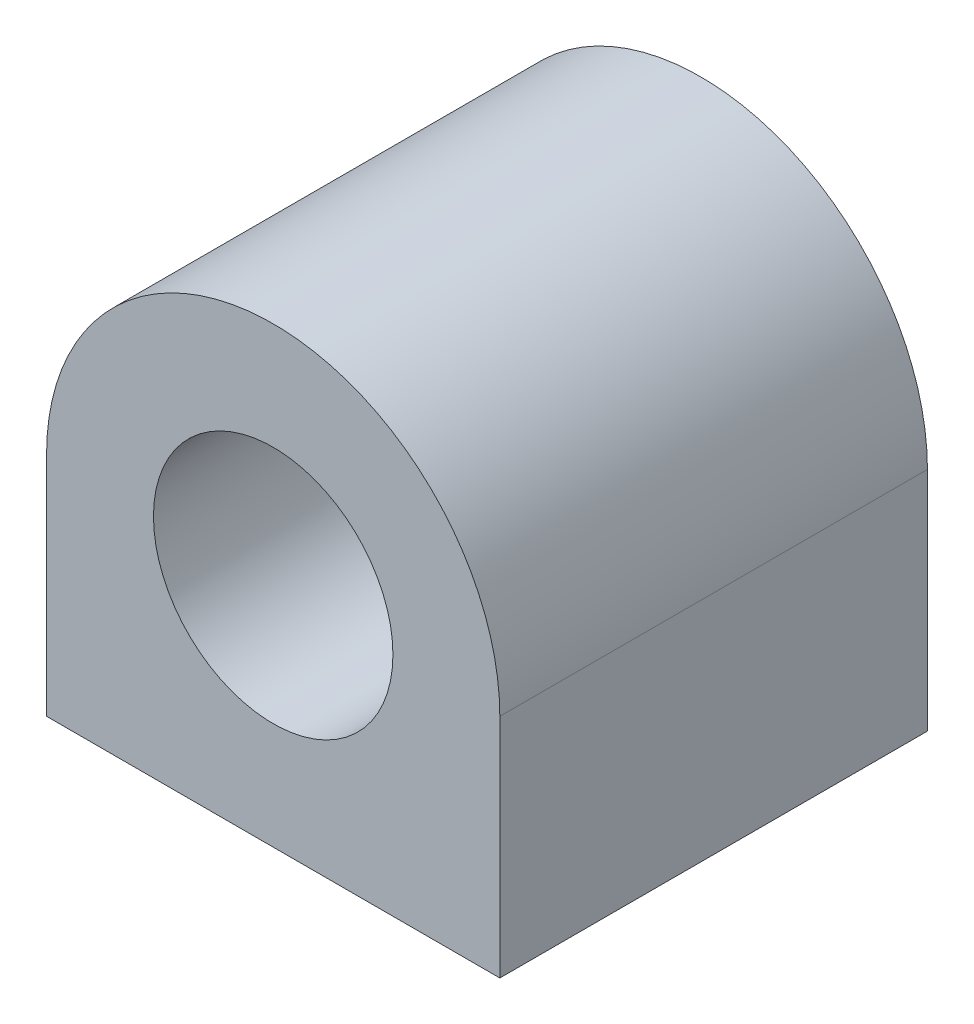
from build123d import *

# Parameters (mm, degrees)
SKETCH_1_R            = 5.6
EXTRUDE_394_DEPTH     = 10
SKETCH_3_R            = 1.2
CUT_EXTRUDE_678_DEPTH = 11


with BuildPart() as part:
    # Эскиз1 → Extrude 394 (new, symmetric)
    with BuildSketch(Plane.XY):
        with BuildLine():
            Line((-10.6, 0), (-10.6, -10.6))
            Line((-10.6, -10.6), (10.6, -10.6))
            Line((10.6, -10.6), (10.6, 0))
            ThreePointArc((10.6, 0), (0, 10.6), (-10.6, 0))
        make_face()
        Circle(SKETCH_1_R, mode=Mode.SUBTRACT)
    extrude(amount=EXTRUDE_394_DEPTH, both=True)

    # Эскиз3 → Cut-Extrude 678 (cut)
    with BuildSketch(Plane.XZ.offset(10.6)):
        with Locations(Location((-7.5, 0, 0), (0, 0, 270))):
            Circle(SKETCH_3_R)
        with Locations(Location((7.5, 0, 0), (0, 0, 90))):
            Circle(SKETCH_3_R)
    extrude(amount=-CUT_EXTRUDE_678_DEPTH, mode=Mode.SUBTRACT)


solid = part.part
